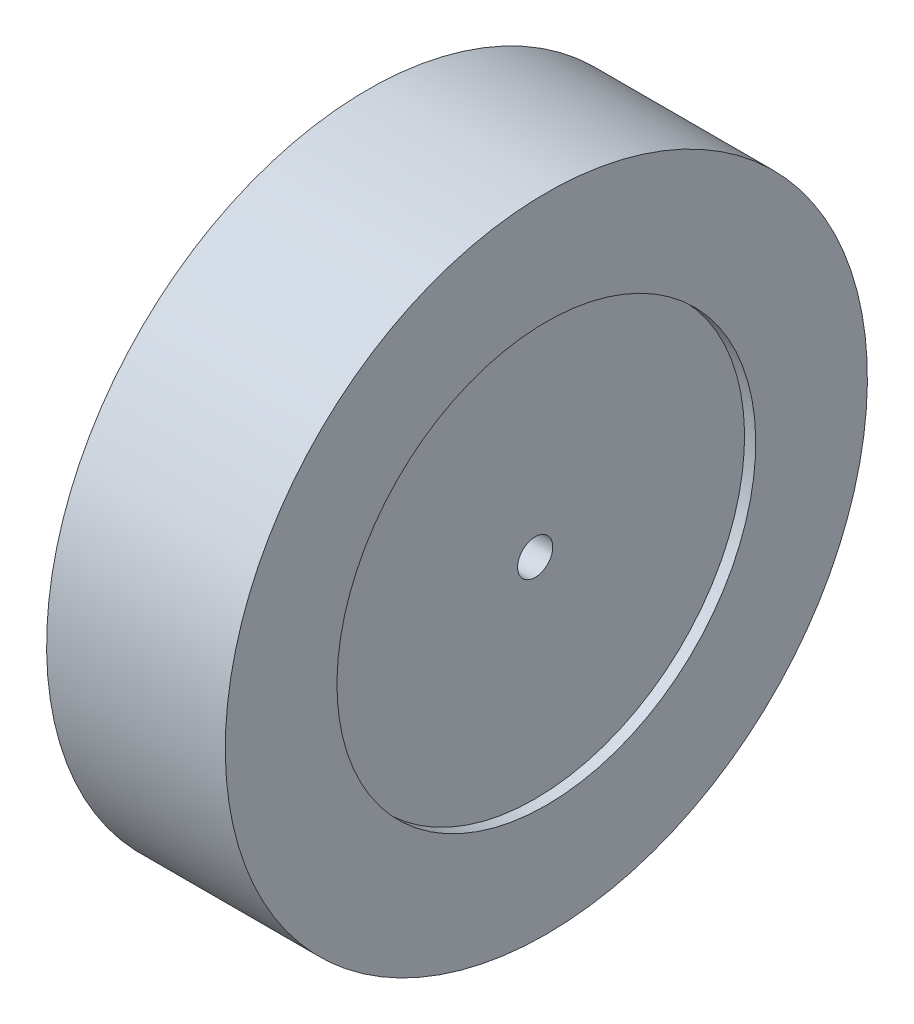
from build123d import *


with BuildPart() as part:
    # Sketch1 → Revolve1 (revolve)
    with BuildSketch(Plane.XY, mode=Mode.PRIVATE) as revolve1_sk:
        Polygon((0, 36.5125), (0, 2), (8.89, 2), (8.89, 23.8125), (10.16, 23.8125), (10.16, 36.5125), align=None)
        Polygon((-8.89, 23.8125), (-8.89, 2), (0, 2), (0, 36.5125), (-10.16, 36.5125), (-10.16, 23.8125), align=None)
    revolve(revolve1_sk.sketch.rotate(Axis((-8.89, 0, 0), (1, 0, 0)), 180), axis=Axis((-8.89, 0, 0), (1, 0, 0)))


solid = part.part
